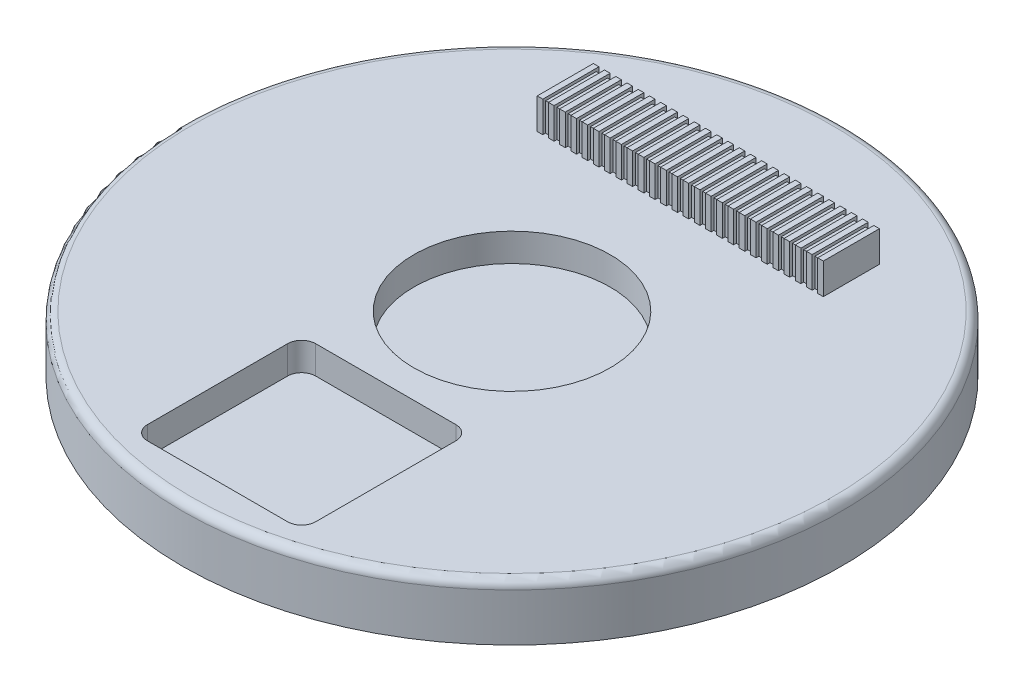
from build123d import *

# Parameters (mm, degrees)
SKETCH1_R           = 117.5
BOSS_EXTRUDE1_DEPTH = 20
SKETCH2_R           = 35
CUT_EXTRUDE1_DEPTH  = 10
SKETCH3_W           = 102
SKETCH3_H           = 20
BOSS_EXTRUDE2_DEPTH = 10
SKETCH6_W           = 2
SKETCH6_H           = 20
BOSS_EXTRUDE3_DEPTH = 1
SKETCH7_W           = 2
SKETCH7_H           = 10
CUT_EXTRUDE2_DEPTH  = 1
SKETCH8_W           = 2
SKETCH8_H           = 10
CUT_EXTRUDE3_DEPTH  = 1
FILLET3_R           = 3


with BuildPart() as part:
    # Sketch1 → Boss-Extrude1 (new body)
    with BuildSketch(Plane(origin=(0, 0, 0), x_dir=(1, 0, 0), z_dir=(0, 1, 0))):
        with Locations(Location((0, 0, 0), (0, 0, 270))):
            Circle(SKETCH1_R)
    extrude(amount=BOSS_EXTRUDE1_DEPTH)

    # Sketch2 → Cut-Extrude1 (cut)
    with BuildSketch(Plane(origin=(0, 20, 0), x_dir=(1, 0, 0), z_dir=(0, 1, 0))):
        with Locations(Location((0, 0, 0), (0, 0, 270))):
            Circle(SKETCH2_R)
        with BuildLine():
            Line((-25, -105), (25, -105))
            ThreePointArc((25, -105), (28.535533906, -103.535533906), (30, -100))
            Line((30, -100), (30, -50))
            ThreePointArc((30, -50), (28.535533906, -46.464466094), (25, -45))
            Line((25, -45), (-25, -45))
            ThreePointArc((-25, -45), (-28.535533906, -46.464466094), (-30, -50))
            Line((-30, -50), (-30, -100))
            ThreePointArc((-30, -100), (-28.535533906, -103.535533906), (-25, -105))
        make_face()
    extrude(amount=-CUT_EXTRUDE1_DEPTH, mode=Mode.SUBTRACT)

    # Sketch3 → Boss-Extrude2 (add)
    with BuildSketch(Plane(origin=(0, 20, 0), x_dir=(1, 0, 0), z_dir=(0, 1, 0))):
        with Locations((0, 70)):
            Rectangle(SKETCH3_W, SKETCH3_H)
    extrude(amount=BOSS_EXTRUDE2_DEPTH)

    # Sketch6 → Boss-Extrude3 (add)
    with BuildSketch(Plane(origin=(0, 30, 0), x_dir=(1, 0, 0), z_dir=(0, 1, 0))):
        with Locations((-50, 70)):
            Rectangle(SKETCH6_W, SKETCH6_H)
        with Locations((-46, 70)):
            Rectangle(SKETCH6_W, SKETCH6_H)
        with Locations((-42, 70)):
            Rectangle(SKETCH6_W, SKETCH6_H)
        with Locations((-38, 70)):
            Rectangle(SKETCH6_W, SKETCH6_H)
        with Locations((-34, 70)):
            Rectangle(SKETCH6_W, SKETCH6_H)
        with Locations((-30, 70)):
            Rectangle(SKETCH6_W, SKETCH6_H)
        with Locations((-26, 70)):
            Rectangle(SKETCH6_W, SKETCH6_H)
        with Locations((-22, 70)):
            Rectangle(SKETCH6_W, SKETCH6_H)
        with Locations((-18, 70)):
            Rectangle(SKETCH6_W, SKETCH6_H)
        with Locations((-14, 70)):
            Rectangle(SKETCH6_W, SKETCH6_H)
        with Locations((-10, 70)):
            Rectangle(SKETCH6_W, SKETCH6_H)
        with Locations((-6, 70)):
            Rectangle(SKETCH6_W, SKETCH6_H)
        with Locations((-2, 70)):
            Rectangle(SKETCH6_W, SKETCH6_H)
        with Locations((2, 70)):
            Rectangle(SKETCH6_W, SKETCH6_H)
        with Locations((6, 70)):
            Rectangle(SKETCH6_W, SKETCH6_H)
        with Locations((10, 70)):
            Rectangle(SKETCH6_W, SKETCH6_H)
        with Locations((14, 70)):
            Rectangle(SKETCH6_W, SKETCH6_H)
        with Locations((18, 70)):
            Rectangle(SKETCH6_W, SKETCH6_H)
        with Locations((22, 70)):
            Rectangle(SKETCH6_W, SKETCH6_H)
        with Locations((26, 70)):
            Rectangle(SKETCH6_W, SKETCH6_H)
        with Locations((30, 70)):
            Rectangle(SKETCH6_W, SKETCH6_H)
        with Locations((34, 70)):
            Rectangle(SKETCH6_W, SKETCH6_H)
        with Locations((38, 70)):
            Rectangle(SKETCH6_W, SKETCH6_H)
        with Locations((42, 70)):
            Rectangle(SKETCH6_W, SKETCH6_H)
        with Locations((46, 70)):
            Rectangle(SKETCH6_W, SKETCH6_H)
        with Locations((50, 70)):
            Rectangle(SKETCH6_W, SKETCH6_H)
    extrude(amount=BOSS_EXTRUDE3_DEPTH)

    # Sketch7 → Cut-Extrude2 (cut)
    with BuildSketch(Plane.XY.offset(-60)):
        with Locations((-48, 25)):
            Rectangle(SKETCH7_W, SKETCH7_H)
        with Locations((-44, 25)):
            Rectangle(SKETCH7_W, SKETCH7_H)
        with Locations((-40, 25)):
            Rectangle(SKETCH7_W, SKETCH7_H)
        with Locations((-36, 25)):
            Rectangle(SKETCH7_W, SKETCH7_H)
        with Locations((-32, 25)):
            Rectangle(SKETCH7_W, SKETCH7_H)
        with Locations((-28, 25)):
            Rectangle(SKETCH7_W, SKETCH7_H)
        with Locations((-24, 25)):
            Rectangle(SKETCH7_W, SKETCH7_H)
        with Locations((-20, 25)):
            Rectangle(SKETCH7_W, SKETCH7_H)
        with Locations((-16, 25)):
            Rectangle(SKETCH7_W, SKETCH7_H)
        with Locations((-12, 25)):
            Rectangle(SKETCH7_W, SKETCH7_H)
        with Locations((-8, 25)):
            Rectangle(SKETCH7_W, SKETCH7_H)
        with Locations((-4, 25)):
            Rectangle(SKETCH7_W, SKETCH7_H)
        with Locations((0, 25)):
            Rectangle(SKETCH7_W, SKETCH7_H)
        with Locations((4, 25)):
            Rectangle(SKETCH7_W, SKETCH7_H)
        with Locations((8, 25)):
            Rectangle(SKETCH7_W, SKETCH7_H)
        with Locations((12, 25)):
            Rectangle(SKETCH7_W, SKETCH7_H)
        with Locations((16, 25)):
            Rectangle(SKETCH7_W, SKETCH7_H)
        with Locations((20, 25)):
            Rectangle(SKETCH7_W, SKETCH7_H)
        with Locations((24, 25)):
            Rectangle(SKETCH7_W, SKETCH7_H)
        with Locations((28, 25)):
            Rectangle(SKETCH7_W, SKETCH7_H)
        with Locations((32, 25)):
            Rectangle(SKETCH7_W, SKETCH7_H)
        with Locations((36, 25)):
            Rectangle(SKETCH7_W, SKETCH7_H)
        with Locations((40, 25)):
            Rectangle(SKETCH7_W, SKETCH7_H)
        with Locations((44, 25)):
            Rectangle(SKETCH7_W, SKETCH7_H)
        with Locations((48, 25)):
            Rectangle(SKETCH7_W, SKETCH7_H)
    extrude(amount=-CUT_EXTRUDE2_DEPTH, mode=Mode.SUBTRACT)

    # Sketch8 → Cut-Extrude3 (cut)
    with BuildSketch(Plane(origin=(0, 0, -80), x_dir=(-1, 0, 0), z_dir=(0, 0, -1))):
        with Locations((-48, 25)):
            Rectangle(SKETCH8_W, SKETCH8_H)
        with Locations((-44, 25)):
            Rectangle(SKETCH8_W, SKETCH8_H)
        with Locations((-40, 25)):
            Rectangle(SKETCH8_W, SKETCH8_H)
        with Locations((-36, 25)):
            Rectangle(SKETCH8_W, SKETCH8_H)
        with Locations((-32, 25)):
            Rectangle(SKETCH8_W, SKETCH8_H)
        with Locations((-28, 25)):
            Rectangle(SKETCH8_W, SKETCH8_H)
        with Locations((-24, 25)):
            Rectangle(SKETCH8_W, SKETCH8_H)
        with Locations((-20, 25)):
            Rectangle(SKETCH8_W, SKETCH8_H)
        with Locations((-16, 25)):
            Rectangle(SKETCH8_W, SKETCH8_H)
        with Locations((-12, 25)):
            Rectangle(SKETCH8_W, SKETCH8_H)
        with Locations((-8, 25)):
            Rectangle(SKETCH8_W, SKETCH8_H)
        with Locations((-4, 25)):
            Rectangle(SKETCH8_W, SKETCH8_H)
        with Locations((0, 25)):
            Rectangle(SKETCH8_W, SKETCH8_H)
        with Locations((4, 25)):
            Rectangle(SKETCH8_W, SKETCH8_H)
        with Locations((8, 25)):
            Rectangle(SKETCH8_W, SKETCH8_H)
        with Locations((12, 25)):
            Rectangle(SKETCH8_W, SKETCH8_H)
        with Locations((16, 25)):
            Rectangle(SKETCH8_W, SKETCH8_H)
        with Locations((20, 25)):
            Rectangle(SKETCH8_W, SKETCH8_H)
        with Locations((24, 25)):
            Rectangle(SKETCH8_W, SKETCH8_H)
        with Locations((28, 25)):
            Rectangle(SKETCH8_W, SKETCH8_H)
        with Locations((32, 25)):
            Rectangle(SKETCH8_W, SKETCH8_H)
        with Locations((36, 25)):
            Rectangle(SKETCH8_W, SKETCH8_H)
        with Locations((40, 25)):
            Rectangle(SKETCH8_W, SKETCH8_H)
        with Locations((44, 25)):
            Rectangle(SKETCH8_W, SKETCH8_H)
        with Locations((48, 25)):
            Rectangle(SKETCH8_W, SKETCH8_H)
    extrude(amount=-CUT_EXTRUDE3_DEPTH, mode=Mode.SUBTRACT)

    # Fillet3
    fillet3_edges = [part.edges().sort_by_distance(p)[0] for p in [
        (0, 20, -117.5),
    ]]
    fillet(fillet3_edges, radius=FILLET3_R)


solid = part.part
